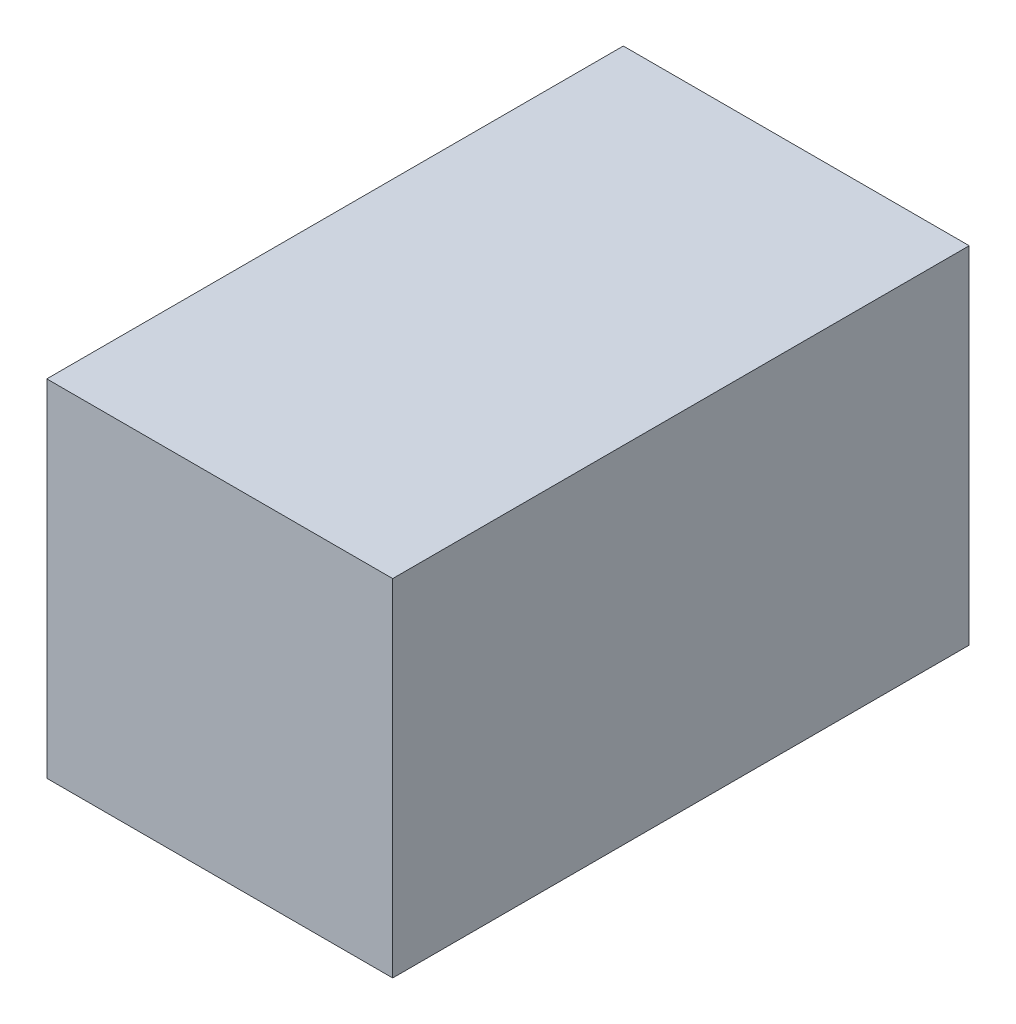
from build123d import *

# Parameters (mm, degrees)
SKETCH1_W           = 15
SKETCH1_H           = 15
BOSS_EXTRUDE1_DEPTH = 25


with BuildPart() as part:
    # Sketch1 → Boss-Extrude1 (new body)
    with BuildSketch(Plane.XY):
        Rectangle(SKETCH1_W, SKETCH1_H)
    extrude(amount=BOSS_EXTRUDE1_DEPTH)


solid = part.part
